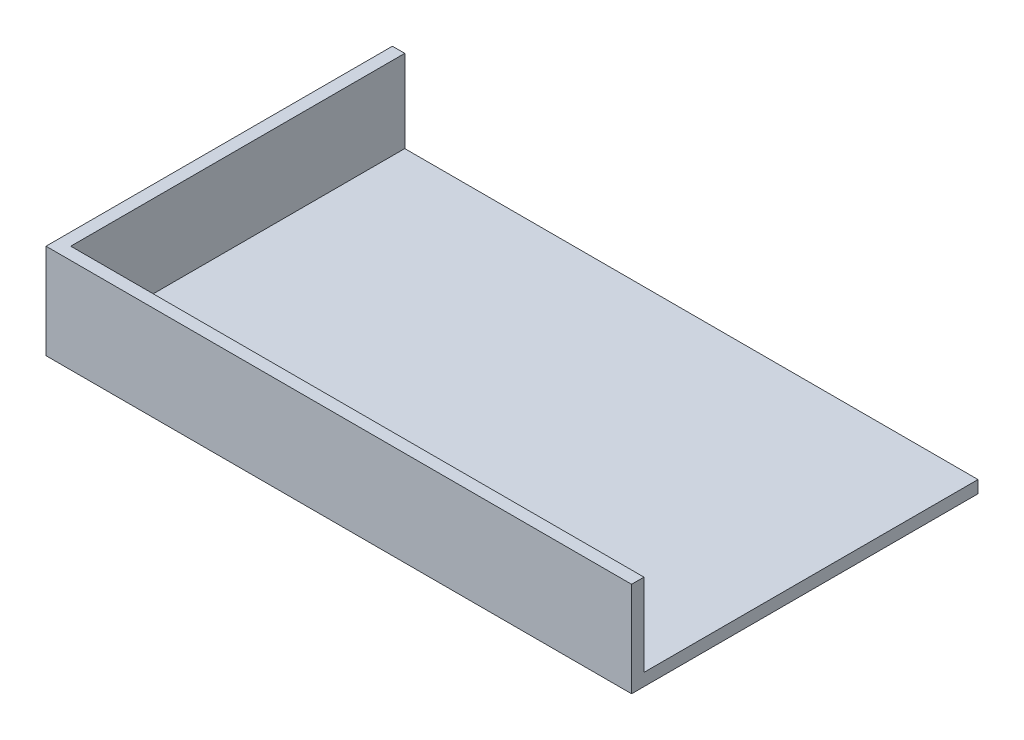
from build123d import *

# Parameters (mm, degrees)
SKETCH2_W           = 142
SKETCH2_H           = 84
BOSS_EXTRUDE1_DEPTH = 3
SKETCH3_W           = 142
SKETCH3_H           = 3
BOSS_EXTRUDE2_DEPTH = 20
SKETCH4_W           = 3
SKETCH4_H           = 81
BOSS_EXTRUDE3_DEPTH = 20


with BuildPart() as part:
    # Sketch2 → Boss-Extrude1 (new body)
    with BuildSketch(Plane(origin=(0, 0, 0), x_dir=(1, 0, 0), z_dir=(0, 1, 0))):
        with Locations((71, -42)):
            Rectangle(SKETCH2_W, SKETCH2_H)
    extrude(amount=BOSS_EXTRUDE1_DEPTH)

    # Sketch3 → Boss-Extrude2 (add)
    with BuildSketch(Plane(origin=(0, 3, 0), x_dir=(1, 0, 0), z_dir=(0, 1, 0))):
        with Locations((71, -82.5)):
            Rectangle(SKETCH3_W, SKETCH3_H)
    extrude(amount=BOSS_EXTRUDE2_DEPTH)

    # Sketch4 → Boss-Extrude3 (add)
    with BuildSketch(Plane(origin=(0, 3, 0), x_dir=(1, 0, 0), z_dir=(0, 1, 0))):
        with Locations((1.5, -40.5)):
            Rectangle(SKETCH4_W, SKETCH4_H)
    extrude(amount=BOSS_EXTRUDE3_DEPTH)


solid = part.part
